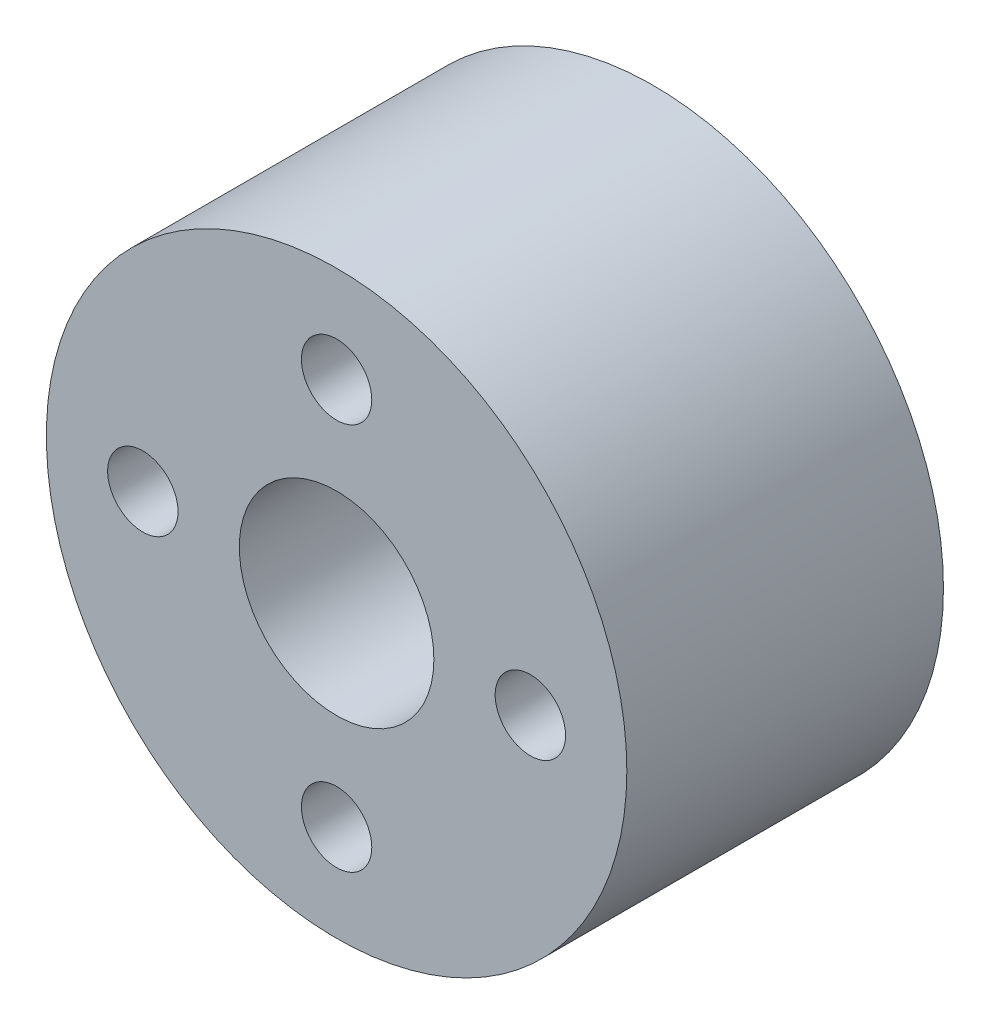
from build123d import *

# Parameters (mm, degrees)
BOSS_EXTRUDE1_DEPTH      = 38.1
BOSS_EXTRUDE1_DEPTH_BACK = 38.1
SKETCH1_R                = 69.85
SKETCH1_R_2              = 23.412602146
SKETCH1_R_3              = 8.466666667


with BuildPart() as part:
    # Sketch1 → Boss-Extrude1 (new, two sides: drawn at the far end of the back side and taken through both)
    with BuildSketch(Plane.XY.offset(-BOSS_EXTRUDE1_DEPTH_BACK)):
        Circle(SKETCH1_R)
        Circle(SKETCH1_R_2, mode=Mode.SUBTRACT)
        with Locations((-46.631301073, 0)):
            Circle(SKETCH1_R_3, mode=Mode.SUBTRACT)
        with Locations((0, 46.631301073)):
            Circle(SKETCH1_R_3, mode=Mode.SUBTRACT)
        with Locations((46.631301073, 0)):
            Circle(SKETCH1_R_3, mode=Mode.SUBTRACT)
        with Locations((0, -46.631301073)):
            Circle(SKETCH1_R_3, mode=Mode.SUBTRACT)
    extrude(amount=BOSS_EXTRUDE1_DEPTH + BOSS_EXTRUDE1_DEPTH_BACK)


solid = part.part
